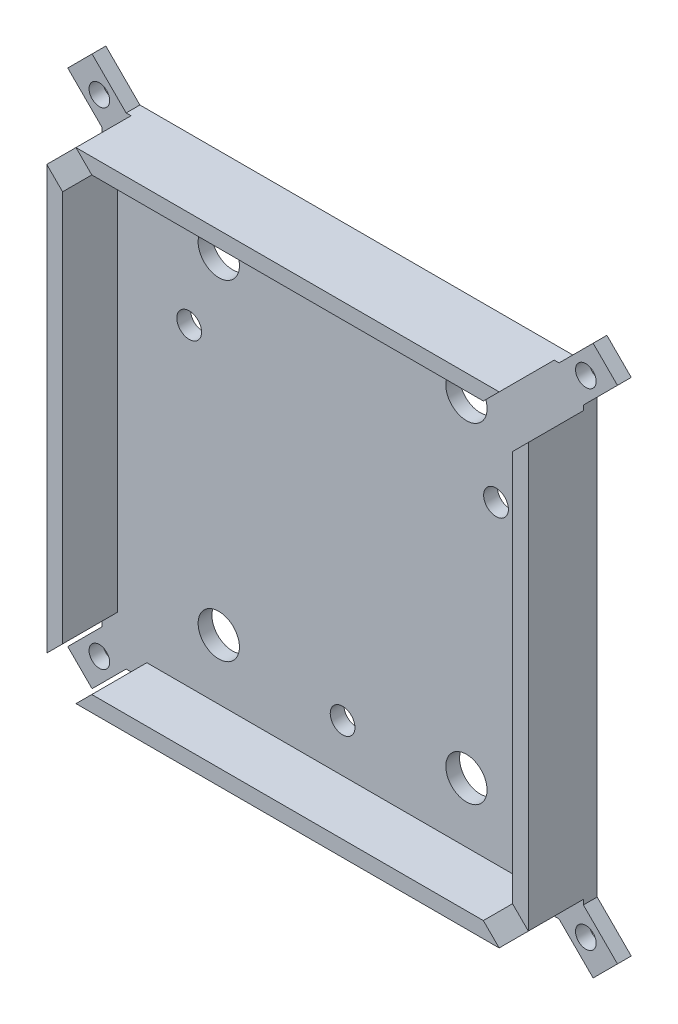
from build123d import *

# Parameters (mm, degrees)
EXTRUDE_1_DEPTH     = 10
CUT_EXTRUDE_1_DEPTH = 8
CUT_EXTRUDE_2_REACH = 52.498
SKETCH_3_R          = 1.8
SKETCH_4_R          = 3
CUT_EXTRUDE_3_DEPTH = 51.497524692
EXTRUDE_START       = -10
EXTRUDE_2_DEPTH     = 10
CUT_EXTRUDE_4_DEPTH = 8
CUT_EXTRUDE_5_REACH = 59.064
SKETCH_7_R          = 1.5


with BuildPart() as part:
    # 草图1 → 凸台-拉伸1 (new body)
    with BuildSketch(Plane.XY):
        with BuildLine():
            Line((-33, -35), (33, -35))
            ThreePointArc((33, -35), (34.414213562, -34.414213562), (35, -33))
            Line((35, -33), (35, 33))
            ThreePointArc((35, 33), (34.414213562, 34.414213562), (33, 35))
            Line((33, 35), (-33, 35))
            ThreePointArc((-33, 35), (-34.414213562, 34.414213562), (-35, 33))
            Line((-35, 33), (-35, -33))
            ThreePointArc((-35, -33), (-34.414213562, -34.414213562), (-33, -35))
        make_face()
    extrude(amount=EXTRUDE_1_DEPTH)

    # 草图2 → 切除-拉伸1 (cut)
    with BuildSketch(Plane.XY.offset(10)):
        with BuildLine():
            Line((-29.7, -32.7), (29.7, -32.7))
            ThreePointArc((29.7, -32.7), (31.821320344, -31.821320344), (32.7, -29.7))
            Line((32.7, -29.7), (32.7, 29.7))
            ThreePointArc((32.7, 29.7), (31.821320344, 31.821320344), (29.7, 32.7))
            Line((29.7, 32.7), (-29.7, 32.7))
            ThreePointArc((-29.7, 32.7), (-31.821320344, 31.821320344), (-32.7, 29.7))
            Line((-32.7, 29.7), (-32.7, -29.7))
            ThreePointArc((-32.7, -29.7), (-31.821320344, -31.821320344), (-29.7, -32.7))
        make_face()
    extrude(amount=-CUT_EXTRUDE_1_DEPTH, mode=Mode.SUBTRACT)

    # 草图3 → 切除-拉伸2 (cut, up to next)
    with BuildSketch(Plane(origin=(0, 0, 0), x_dir=(-1, 0, 0), z_dir=(0, 0, -1)), mode=Mode.PRIVATE) as cut_extrude_2_sk1:
        with Locations((-22.300154147, 12.875)):
            Circle(SKETCH_3_R)
    cut_extrude_2_tool1 = extrude(cut_extrude_2_sk1.sketch, amount=-CUT_EXTRUDE_2_REACH, mode=Mode.PRIVATE) & part.part
    # 草图3 → 切除-拉伸2 (cut, up to next)
    with BuildSketch(Plane(origin=(0, 0, 0), x_dir=(-1, 0, 0), z_dir=(0, 0, -1)), mode=Mode.PRIVATE) as cut_extrude_2_sk2:
        with Locations((22.300154147, 12.875)):
            Circle(SKETCH_3_R)
    cut_extrude_2_tool2 = extrude(cut_extrude_2_sk2.sketch, amount=-CUT_EXTRUDE_2_REACH, mode=Mode.PRIVATE) & part.part
    # 草图3 → 切除-拉伸2 (cut, up to next)
    with BuildSketch(Plane(origin=(0, 0, 0), x_dir=(-1, 0, 0), z_dir=(0, 0, -1)), mode=Mode.PRIVATE) as cut_extrude_2_sk3:
        with Locations((0, -25.75)):
            Circle(SKETCH_3_R)
    cut_extrude_2_tool3 = extrude(cut_extrude_2_sk3.sketch, amount=-CUT_EXTRUDE_2_REACH, mode=Mode.PRIVATE) & part.part
    add(cut_extrude_2_tool1.solids().sort_by_distance((22.300154, 12.875, 0))[0], mode=Mode.SUBTRACT)
    add(cut_extrude_2_tool2.solids().sort_by_distance((-22.300154, 12.875, 0))[0], mode=Mode.SUBTRACT)
    add(cut_extrude_2_tool3.solids().sort_by_distance((0, -25.75, 0))[0], mode=Mode.SUBTRACT)

    # 草图4 → 切除-拉伸3 (cut, through all)
    with BuildSketch(Plane(origin=(0, 0, 0), x_dir=(-1, 0, 0), z_dir=(0, 0, -1))):
        with Locations((-18, 24)):
            Circle(SKETCH_4_R)
        with Locations((18, 24)):
            Circle(SKETCH_4_R)
        with Locations((-18, -24)):
            Circle(SKETCH_4_R)
        with Locations((18, -24)):
            Circle(SKETCH_4_R)
    extrude(amount=-CUT_EXTRUDE_3_DEPTH, mode=Mode.SUBTRACT)

    # 草图5 → 凸台-拉伸2 (add)
    with BuildSketch(Plane.XY.offset(10).offset(EXTRUDE_START)):
        with BuildLine():
            Line((-29.164466094, 32.7), (-31.464466094, 35))
            Line((-31.464466094, 35), (-33, 35))
            ThreePointArc((-33, 35), (-34.414213562, 34.414213562), (-35, 33))
            Line((-35, 33), (-35, 31.464466094))
            Line((-35, 31.464466094), (-32.7, 29.164466094))
            Line((-32.7, 29.164466094), (-32.7, 29.7))
            ThreePointArc((-32.7, 29.7), (-31.821320344, 31.821320344), (-29.7, 32.7))
            Line((-29.7, 32.7), (-29.164466094, 32.7))
        make_face()
        with BuildLine():
            Line((-33, 35), (-31.464466094, 35))
            Line((-31.464466094, 35), (-32.646446609, 36.181980515))
            Line((-32.646446609, 36.181980515), (-36.415999231, 39.951533137))
            Line((-36.415999231, 39.951533137), (-39.951533137, 36.415999231))
            Line((-39.951533137, 36.415999231), (-36.181980515, 32.646446609))
            Line((-36.181980515, 32.646446609), (-35, 31.464466094))
            Line((-35, 31.464466094), (-35, 33))
            ThreePointArc((-35, 33), (-34.414213562, 34.414213562), (-33, 35))
        make_face()
        with BuildLine():
            ThreePointArc((35, 33), (34.414213562, 34.414213562), (33, 35))
            Line((33, 35), (31.464466094, 35))
            Line((31.464466094, 35), (29.164466094, 32.7))
            Line((29.164466094, 32.7), (29.7, 32.7))
            ThreePointArc((29.7, 32.7), (31.821320344, 31.821320344), (32.7, 29.7))
            Line((32.7, 29.7), (32.7, 29.164466094))
            Line((32.7, 29.164466094), (35, 31.464466094))
            Line((35, 31.464466094), (35, 33))
        make_face()
        with BuildLine():
            Line((31.464466094, 35), (33, 35))
            ThreePointArc((33, 35), (34.414213562, 34.414213562), (35, 33))
            Line((35, 33), (35, 31.464466094))
            Line((35, 31.464466094), (36.181980515, 32.646446609))
            Line((36.181980515, 32.646446609), (39.951533137, 36.415999231))
            Line((39.951533137, 36.415999231), (36.415999231, 39.951533137))
            Line((36.415999231, 39.951533137), (32.646446609, 36.181980515))
            Line((32.646446609, 36.181980515), (31.464466094, 35))
        make_face()
        with BuildLine():
            Line((36.181980515, -32.646446609), (35, -31.464466094))
            Line((35, -31.464466094), (35, -33))
            ThreePointArc((35, -33), (34.414213562, -34.414213562), (33, -35))
            Line((33, -35), (31.464466094, -35))
            Line((31.464466094, -35), (32.646446609, -36.181980515))
            Line((32.646446609, -36.181980515), (36.415999231, -39.951533137))
            Line((36.415999231, -39.951533137), (39.951533137, -36.415999231))
            Line((39.951533137, -36.415999231), (36.181980515, -32.646446609))
        make_face()
        with BuildLine():
            Line((35, -33), (35, -31.464466094))
            Line((35, -31.464466094), (32.7, -29.164466094))
            Line((32.7, -29.164466094), (32.7, -29.7))
            ThreePointArc((32.7, -29.7), (31.821320344, -31.821320344), (29.7, -32.7))
            Line((29.7, -32.7), (29.164466094, -32.7))
            Line((29.164466094, -32.7), (31.464466094, -35))
            Line((31.464466094, -35), (33, -35))
            ThreePointArc((33, -35), (34.414213562, -34.414213562), (35, -33))
        make_face()
        with BuildLine():
            Line((-35, -33), (-35, -31.464466094))
            Line((-35, -31.464466094), (-36.181980515, -32.646446609))
            Line((-36.181980515, -32.646446609), (-39.951533137, -36.415999231))
            Line((-39.951533137, -36.415999231), (-36.415999231, -39.951533137))
            Line((-36.415999231, -39.951533137), (-32.646446609, -36.181980515))
            Line((-32.646446609, -36.181980515), (-31.464466094, -35))
            Line((-31.464466094, -35), (-33, -35))
            ThreePointArc((-33, -35), (-34.414213562, -34.414213562), (-35, -33))
        make_face()
        with BuildLine():
            Line((-32.7, -29.164466094), (-35, -31.464466094))
            Line((-35, -31.464466094), (-35, -33))
            ThreePointArc((-35, -33), (-34.414213562, -34.414213562), (-33, -35))
            Line((-33, -35), (-31.464466094, -35))
            Line((-31.464466094, -35), (-29.164466094, -32.7))
            Line((-29.164466094, -32.7), (-29.7, -32.7))
            ThreePointArc((-29.7, -32.7), (-31.821320344, -31.821320344), (-32.7, -29.7))
            Line((-32.7, -29.7), (-32.7, -29.164466094))
        make_face()
    extrude(amount=EXTRUDE_2_DEPTH)

    # 草图6 → 切除-拉伸4 (cut)
    with BuildSketch(Plane.XY.offset(10)):
        with BuildLine():
            Line((-30.757359313, -35), (-28.457359313, -32.7))
            Line((-28.457359313, -32.7), (-29.7, -32.7))
            ThreePointArc((-29.7, -32.7), (-31.821320344, -31.821320344), (-32.7, -29.7))
            Line((-32.7, -29.7), (-32.7, -28.457359313))
            Line((-32.7, -28.457359313), (-35, -30.757359313))
            Line((-35, -30.757359313), (-35, -31.464466094))
            Line((-35, -31.464466094), (-39.951533137, -36.415999231))
            Line((-39.951533137, -36.415999231), (-36.415999231, -39.951533137))
            Line((-36.415999231, -39.951533137), (-31.464466094, -35))
            Line((-31.464466094, -35), (-30.757359313, -35))
        make_face()
        with BuildLine():
            Line((-28.457359313, -32.7), (-28.257359313, -32.5))
            Line((-28.257359313, -32.5), (-27.64321207, -31.885852757))
            Line((-27.64321207, -31.885852757), (-31.885852757, -27.64321207))
            Line((-31.885852757, -27.64321207), (-32.5, -28.257359313))
            Line((-32.5, -28.257359313), (-32.7, -28.457359313))
            Line((-32.7, -28.457359313), (-32.7, -29.7))
            ThreePointArc((-32.7, -29.7), (-31.821320344, -31.821320344), (-29.7, -32.7))
            Line((-29.7, -32.7), (-28.457359313, -32.7))
        make_face()
        with BuildLine():
            Line((29.7, -32.7), (28.457359313, -32.7))
            Line((28.457359313, -32.7), (30.757359313, -35))
            Line((30.757359313, -35), (31.464466094, -35))
            Line((31.464466094, -35), (36.415999231, -39.951533137))
            Line((36.415999231, -39.951533137), (39.951533137, -36.415999231))
            Line((39.951533137, -36.415999231), (35, -31.464466094))
            Line((35, -31.464466094), (35, -30.757359313))
            Line((35, -30.757359313), (32.7, -28.457359313))
            Line((32.7, -28.457359313), (32.7, -29.7))
            ThreePointArc((32.7, -29.7), (31.821320344, -31.821320344), (29.7, -32.7))
        make_face()
        with BuildLine():
            Line((27.64321207, -31.885852757), (28.257359313, -32.5))
            Line((28.257359313, -32.5), (28.457359313, -32.7))
            Line((28.457359313, -32.7), (29.7, -32.7))
            ThreePointArc((29.7, -32.7), (31.821320344, -31.821320344), (32.7, -29.7))
            Line((32.7, -29.7), (32.7, -28.457359313))
            Line((32.7, -28.457359313), (32.5, -28.257359313))
            Line((32.5, -28.257359313), (31.885852757, -27.64321207))
            Line((31.885852757, -27.64321207), (27.64321207, -31.885852757))
        make_face()
        with BuildLine():
            Line((32.7, 29.7), (32.7, 28.457359313))
            Line((32.7, 28.457359313), (35, 30.757359313))
            Line((35, 30.757359313), (35, 31.464466094))
            Line((35, 31.464466094), (39.951533137, 36.415999231))
            Line((39.951533137, 36.415999231), (36.415999231, 39.951533137))
            Line((36.415999231, 39.951533137), (31.464466094, 35))
            Line((31.464466094, 35), (30.757359313, 35))
            Line((30.757359313, 35), (28.457359313, 32.7))
            Line((28.457359313, 32.7), (29.7, 32.7))
            ThreePointArc((29.7, 32.7), (31.821320344, 31.821320344), (32.7, 29.7))
        make_face()
        with BuildLine():
            Line((31.885852757, 27.64321207), (32.5, 28.257359313))
            Line((32.5, 28.257359313), (32.7, 28.457359313))
            Line((32.7, 28.457359313), (32.7, 29.7))
            ThreePointArc((32.7, 29.7), (31.821320344, 31.821320344), (29.7, 32.7))
            Line((29.7, 32.7), (28.457359313, 32.7))
            Line((28.457359313, 32.7), (28.257359313, 32.5))
            Line((28.257359313, 32.5), (27.64321207, 31.885852757))
            Line((27.64321207, 31.885852757), (31.885852757, 27.64321207))
        make_face()
        with BuildLine():
            Line((-32.7, 28.457359313), (-32.5, 28.257359313))
            Line((-32.5, 28.257359313), (-31.885852757, 27.64321207))
            Line((-31.885852757, 27.64321207), (-27.64321207, 31.885852757))
            Line((-27.64321207, 31.885852757), (-28.257359313, 32.5))
            Line((-28.257359313, 32.5), (-28.457359313, 32.7))
            Line((-28.457359313, 32.7), (-29.7, 32.7))
            ThreePointArc((-29.7, 32.7), (-31.821320344, 31.821320344), (-32.7, 29.7))
            Line((-32.7, 29.7), (-32.7, 28.457359313))
        make_face()
        with BuildLine():
            Line((-35, 30.757359313), (-32.7, 28.457359313))
            Line((-32.7, 28.457359313), (-32.7, 29.7))
            ThreePointArc((-32.7, 29.7), (-31.821320344, 31.821320344), (-29.7, 32.7))
            Line((-29.7, 32.7), (-28.457359313, 32.7))
            Line((-28.457359313, 32.7), (-30.757359313, 35))
            Line((-30.757359313, 35), (-31.464466094, 35))
            Line((-31.464466094, 35), (-36.415999231, 39.951533137))
            Line((-36.415999231, 39.951533137), (-39.951533137, 36.415999231))
            Line((-39.951533137, 36.415999231), (-35, 31.464466094))
            Line((-35, 31.464466094), (-35, 30.757359313))
        make_face()
    extrude(amount=-CUT_EXTRUDE_4_DEPTH, mode=Mode.SUBTRACT)

    # 草图7 → 切除-拉伸5 (cut, up to next)
    with BuildSketch(Plane.XY.offset(2), mode=Mode.PRIVATE) as cut_extrude_5_sk1:
        with BuildLine():
            ThreePointArc((-36.415999231, 36.415999231), (-36.415999231, 34.294678888), (-34.294678888, 34.294678888))
            Line((-34.294678888, 34.294678888), (-36.415999231, 36.415999231))
        make_face()
    cut_extrude_5_tool1 = extrude(cut_extrude_5_sk1.sketch, amount=-CUT_EXTRUDE_5_REACH, mode=Mode.PRIVATE) & part.part
    # 草图7 → 切除-拉伸5 (cut, up to next)
    with BuildSketch(Plane.XY.offset(2), mode=Mode.PRIVATE) as cut_extrude_5_sk2:
        with BuildLine():
            Line((-36.415999231, 36.415999231), (-34.294678888, 34.294678888))
            ThreePointArc((-34.294678888, 34.294678888), (-33.969519761, 34.781313911), (-33.855339059, 35.355339059))
            ThreePointArc((-33.855339059, 35.355339059), (-34.781313911, 36.741158358), (-36.415999231, 36.415999231))
        make_face()
    cut_extrude_5_tool2 = extrude(cut_extrude_5_sk2.sketch, amount=-CUT_EXTRUDE_5_REACH, mode=Mode.PRIVATE) & part.part
    # 草图7 → 切除-拉伸5 (cut, up to next)
    with BuildSketch(Plane.XY.offset(2), mode=Mode.PRIVATE) as cut_extrude_5_sk3:
        with BuildLine():
            ThreePointArc((-36.415999231, 36.415999231), (-36.415999231, 34.294678888), (-34.294678888, 34.294678888))
            Line((-34.294678888, 34.294678888), (-36.415999231, 36.415999231))
        make_face()
    cut_extrude_5_tool3 = extrude(cut_extrude_5_sk3.sketch, amount=-CUT_EXTRUDE_5_REACH, mode=Mode.PRIVATE) & part.part
    # 草图7 → 切除-拉伸5 (cut, up to next)
    with BuildSketch(Plane.XY.offset(2), mode=Mode.PRIVATE) as cut_extrude_5_sk4:
        with BuildLine():
            Line((-36.415999231, 36.415999231), (-34.294678888, 34.294678888))
            ThreePointArc((-34.294678888, 34.294678888), (-33.969519761, 34.781313911), (-33.855339059, 35.355339059))
            ThreePointArc((-33.855339059, 35.355339059), (-34.781313911, 36.741158358), (-36.415999231, 36.415999231))
        make_face()
    cut_extrude_5_tool4 = extrude(cut_extrude_5_sk4.sketch, amount=-CUT_EXTRUDE_5_REACH, mode=Mode.PRIVATE) & part.part
    # 草图7 → 切除-拉伸5 (cut, up to next)
    with BuildSketch(Plane.XY.offset(2), mode=Mode.PRIVATE) as cut_extrude_5_sk5:
        with Locations((35.355339059, 35.355339059)):
            Circle(SKETCH_7_R)
    cut_extrude_5_tool5 = extrude(cut_extrude_5_sk5.sketch, amount=-CUT_EXTRUDE_5_REACH, mode=Mode.PRIVATE) & part.part
    # 草图7 → 切除-拉伸5 (cut, up to next)
    with BuildSketch(Plane.XY.offset(2), mode=Mode.PRIVATE) as cut_extrude_5_sk6:
        with Locations((35.355339059, -35.355339059)):
            Circle(SKETCH_7_R)
    cut_extrude_5_tool6 = extrude(cut_extrude_5_sk6.sketch, amount=-CUT_EXTRUDE_5_REACH, mode=Mode.PRIVATE) & part.part
    # 草图7 → 切除-拉伸5 (cut, up to next)
    with BuildSketch(Plane.XY.offset(2), mode=Mode.PRIVATE) as cut_extrude_5_sk7:
        with Locations((-35.355339059, -35.355339059)):
            Circle(SKETCH_7_R)
    cut_extrude_5_tool7 = extrude(cut_extrude_5_sk7.sketch, amount=-CUT_EXTRUDE_5_REACH, mode=Mode.PRIVATE) & part.part
    add(cut_extrude_5_tool1.solids().sort_by_distance((-35.805497, 34.905181, 2))[0], mode=Mode.SUBTRACT)
    add(cut_extrude_5_tool2.solids().sort_by_distance((-34.905181, 35.805497, 2))[0], mode=Mode.SUBTRACT)
    add(cut_extrude_5_tool3.solids().sort_by_distance((-35.805497, 34.905181, 2))[0], mode=Mode.SUBTRACT)
    add(cut_extrude_5_tool4.solids().sort_by_distance((-34.905181, 35.805497, 2))[0], mode=Mode.SUBTRACT)
    add(cut_extrude_5_tool5.solids().sort_by_distance((35.355339, 35.355339, 2))[0], mode=Mode.SUBTRACT)
    add(cut_extrude_5_tool6.solids().sort_by_distance((35.355339, -35.355339, 2))[0], mode=Mode.SUBTRACT)
    add(cut_extrude_5_tool7.solids().sort_by_distance((-35.355339, -35.355339, 2))[0], mode=Mode.SUBTRACT)


solid = part.part
